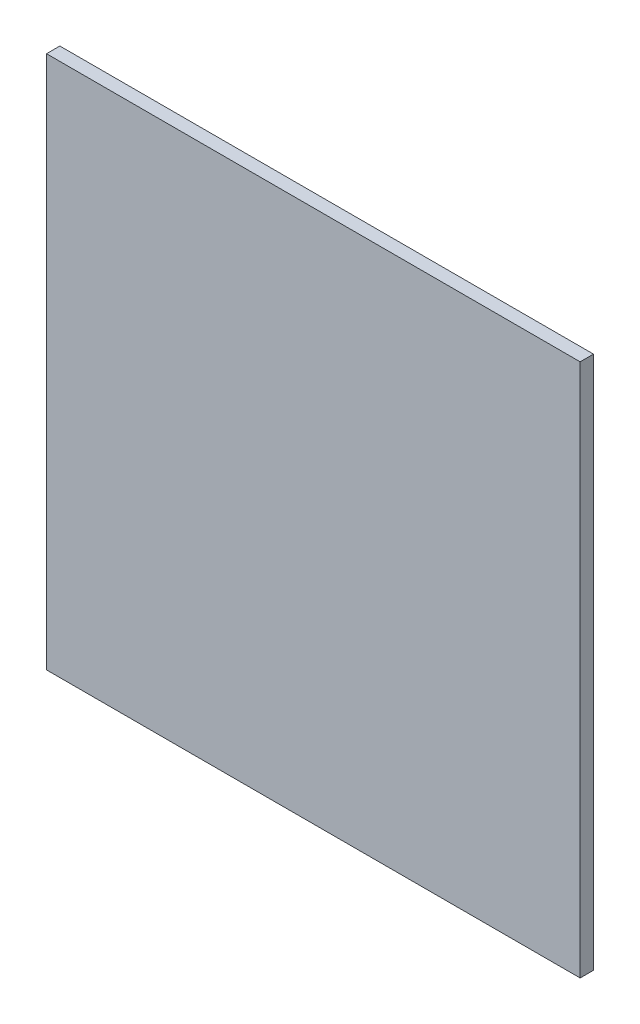
from build123d import *

# Parameters (mm, degrees)
SKETCH_1_W      = 120
SKETCH_1_H      = 120
EXTRUDE_1_DEPTH = 3


with BuildPart() as part:
    # Эскиз1 → Бобышка-Вытянуть1 (new body)
    with BuildSketch(Plane.XY):
        Rectangle(SKETCH_1_W, SKETCH_1_H)
    extrude(amount=EXTRUDE_1_DEPTH)


solid = part.part
